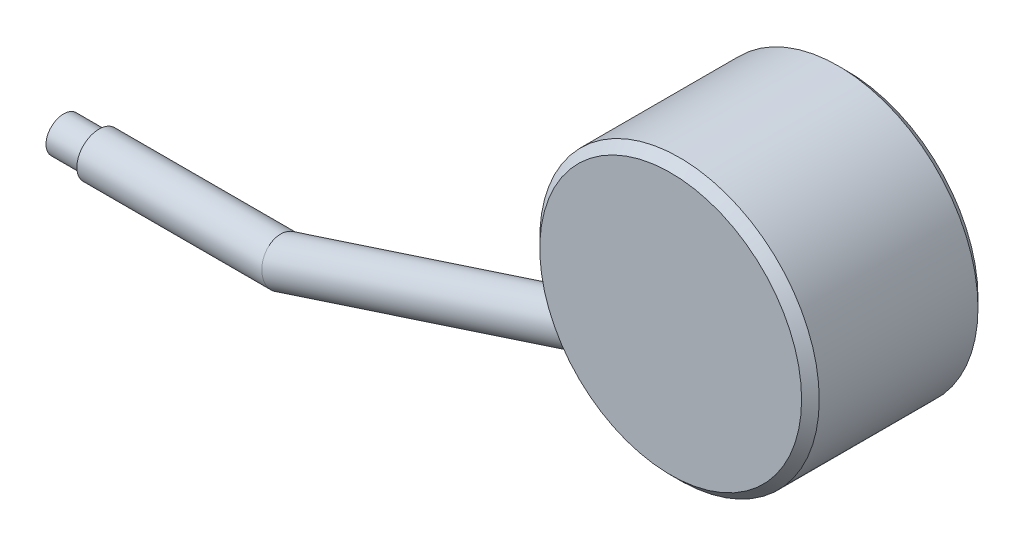
from build123d import *

# Parameters (mm, degrees)
SKETCH2_R                = 5
BOSS_EXTRUDE1_DEPTH      = 20
BOSS_EXTRUDE1_DEPTH_BACK = 20
SKETCH3_R                = 31.686663215
SKETCH4_R                = 8.078892956
SKETCH4_R_2              = 4
CUT_EXTRUDE1_DEPTH       = 8
CHAMFER1_SIZE            = 2


with BuildPart() as part:
    # Sweep1: sweep along a path in Sketch1
    with BuildLine(Plane.XY) as sweep1_path:
        Line((0, 0), (50, 0))
        Line((50, 0), (145.05509307, 31.056871726))
    # Sketch2 → Sweep1 (sweep)
    with BuildSketch(Plane(origin=(0, 0, 0), x_dir=(0, 0, -1), z_dir=(1, 0, 0))):
        Circle(SKETCH2_R)
    sweep(path=sweep1_path.line, transition=Transition.RIGHT)

    # Sketch3 → Boss-Extrude1 (add, two sides: drawn at the far end of the back side and taken through both)
    with BuildSketch(Plane.XY.offset(-BOSS_EXTRUDE1_DEPTH_BACK)):
        with Locations((157.656014811, 51.574343957)):
            Circle(SKETCH3_R)
    extrude(amount=BOSS_EXTRUDE1_DEPTH + BOSS_EXTRUDE1_DEPTH_BACK)

    # Sketch4 → Cut-Extrude1 (cut)
    with BuildSketch(Plane.ZY):
        Circle(SKETCH4_R)
        Circle(SKETCH4_R_2, mode=Mode.SUBTRACT)
    extrude(amount=-CUT_EXTRUDE1_DEPTH, mode=Mode.SUBTRACT)

    # Chamfer1
    chamfer1_edges = [part.edges().sort_by_distance(p)[0] for p in [
        (125.969351596, 51.574343957, 20),
        (125.969351596, 51.574343957, -20),
    ]]
    chamfer(chamfer1_edges, length=CHAMFER1_SIZE)


solid = part.part
